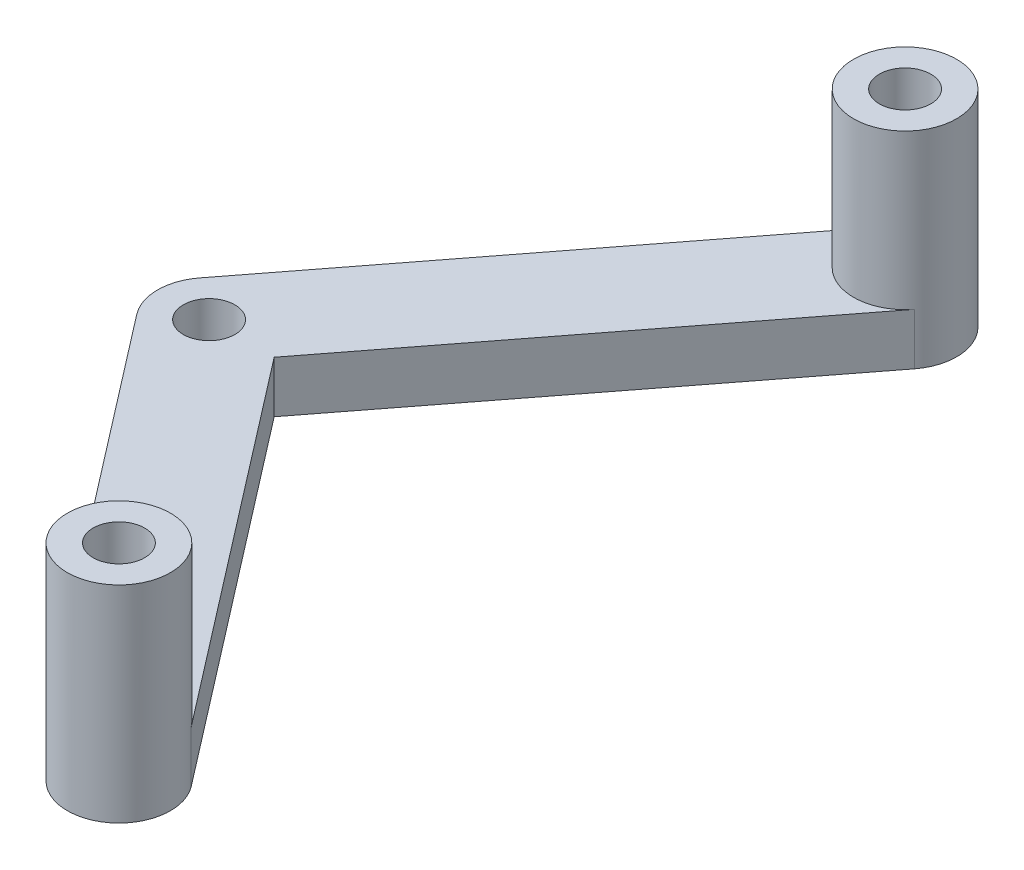
from build123d import *

# Parameters (mm, degrees)
SKETCH1_R           = 1
BOSS_EXTRUDE1_DEPTH = 2
SKETCH3_R           = 2
SKETCH3_R_2         = 1
BOSS_EXTRUDE3_DEPTH = 6


with BuildPart() as part:
    # Sketch1 → Boss-Extrude1 (new body)
    with BuildSketch(Plane(origin=(0, 0, 0), x_dir=(1, 0, 0), z_dir=(0, 1, 0))):
        with BuildLine():
            Line((10.165797332, 16.468729903), (-1.584202668, 1.220779221))
            ThreePointArc((-1.584202668, 1.220779221), (-2, 0), (-1.584202668, -1.220779221))
            Line((-1.584202668, -1.220779221), (10.165797332, -16.468729903))
            ThreePointArc((10.165797332, -16.468729903), (12.970779221, -16.83215335), (13.334202668, -14.027171461))
            Line((13.334202668, -14.027171461), (2.524929468, 0))
            Line((2.524929468, 0), (13.334202668, 14.027171461))
            ThreePointArc((13.334202668, 14.027171461), (12.970779221, 16.83215335), (10.165797332, 16.468729903))
        make_face()
        with Locations(Location((0, 0, 0), (0, 0, 270))):
            Circle(SKETCH1_R, mode=Mode.SUBTRACT)
        with Locations(Location((11.75, 15.247950682, 0), (0, 0, 270))):
            Circle(SKETCH1_R, mode=Mode.SUBTRACT)
        with Locations(Location((11.75, -15.247950682, 0), (0, 0, 90))):
            Circle(SKETCH1_R, mode=Mode.SUBTRACT)
    extrude(amount=BOSS_EXTRUDE1_DEPTH)

    # Sketch3 → Boss-Extrude3 (add)
    # profile 1 of 2: a face of its own
    with BuildSketch(Plane(origin=(0, 2, 0), x_dir=(1, 0, 0), z_dir=(0, 1, 0))):
        with Locations(Location((11.75, 15.247950682, 0), (0, 0, 142.382320334))):
            Circle(SKETCH3_R)
        with Locations(Location((11.75, 15.247950682, 0), (0, 0, 270))):
            Circle(SKETCH3_R_2, mode=Mode.SUBTRACT)
    # profile 2 of 2: a face of its own
    with BuildSketch(Plane(origin=(0, 2, 0), x_dir=(1, 0, 0), z_dir=(0, 1, 0))):
        with Locations(Location((11.75, -15.247950682, 0), (0, 0, 37.617679666))):
            Circle(SKETCH3_R)
        with Locations(Location((11.75, -15.247950682, 0), (0, 0, 90))):
            Circle(SKETCH3_R_2, mode=Mode.SUBTRACT)
    extrude(amount=BOSS_EXTRUDE3_DEPTH)


solid = part.part
